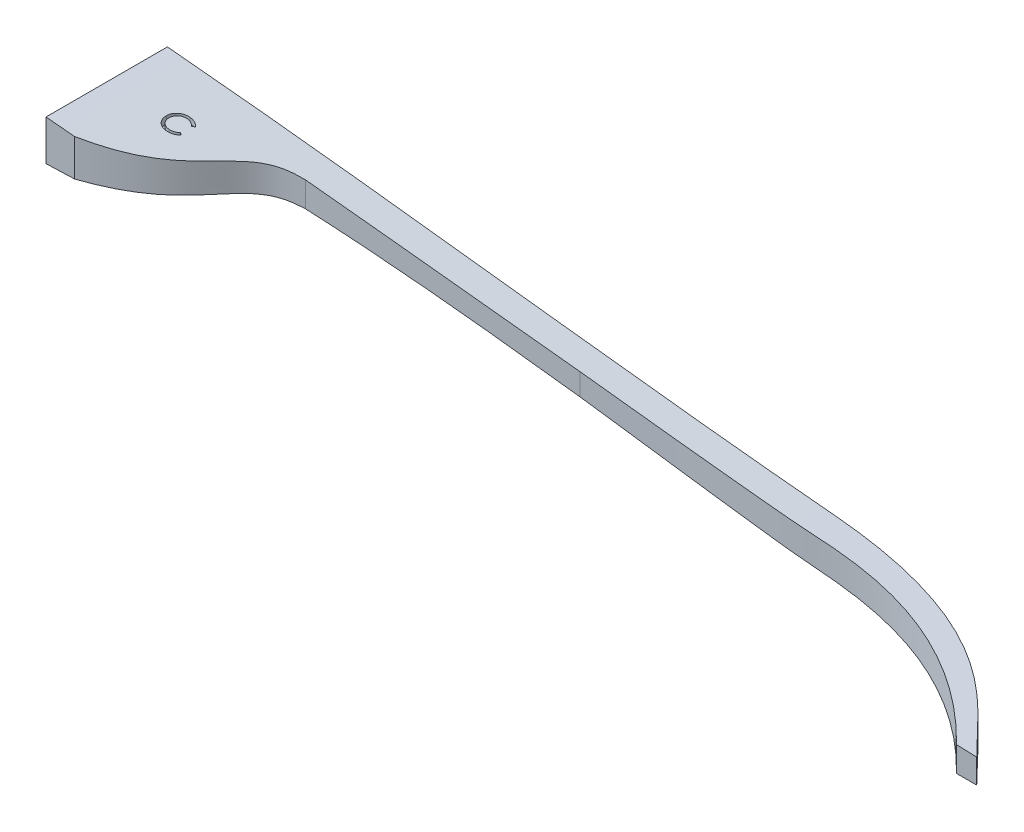
from build123d import *

# Parameters (mm, degrees)
SKETCH1_W           = 146.05
SKETCH1_H           = 19.05
BOSS_EXTRUDE1_DEPTH = 17.78
CUT_EXTRUDE7_DEPTH  = 1.905
CUT_EXTRUDE2_DEPTH  = 19.05
CUT_EXTRUDE3_DEPTH  = 149.356440496
SKETCH5_W           = 6.985
SKETCH5_H           = 3.81
CUT_EXTRUDE4_DEPTH  = 6.35


with BuildPart() as part:
    # Sketch1 → Boss-Extrude1 (new body)
    with BuildSketch(Plane(origin=(0, 0, 0), x_dir=(1, 0, 0), z_dir=(0, 1, 0))):
        with Locations((73.025, 9.525)):
            Rectangle(SKETCH1_W, SKETCH1_H)
    extrude(amount=BOSS_EXTRUDE1_DEPTH)

    # Sketch8 → Cut-Extrude7 (cut)
    with BuildSketch(Plane(origin=(0, 17.78, 0), x_dir=(1, 0, 0), z_dir=(0, 1, 0))):
        with BuildLine():
            Line((11.932128465, 11.486459651), (11.57455635, 11.239664779))
            add(Edge.make_bspline(
                [(11.57455635, 11.239664779), (11.53172956, 11.286575166), (11.447891005, 11.378407848), (11.309829616, 11.498702995), (11.165342586, 11.599950223), (11.014226465, 11.681812452), (10.856321257, 11.745897608), (10.690796367, 11.790426079), (10.517478862, 11.81786797), (10.399345319, 11.821266988), (10.339179747, 11.822998113)],
                knots=[0, 0, 0, 0, 1.078723025, 2.111729107, 3.104379151, 4.071093171, 5.02612831, 5.993405043, 6.978038489, 8, 8, 8, 8], degree=3))
            add(Edge.make_bspline(
                [(10.339179747, 11.822998113), (10.307836215, 11.822546335), (10.245481403, 11.821647569), (10.153078916, 11.811766265), (10.062089791, 11.798241519), (9.972599637, 11.777692061), (9.884767432, 11.750827483), (9.797994731, 11.719672741), (9.713595602, 11.681084488), (9.630751308, 11.638193888), (9.550704857, 11.589951467), (9.475308209, 11.536369665), (9.403189626, 11.479842707), (9.336388016, 11.417697997), (9.274293762, 11.351026195), (9.215546672, 11.280666308), (9.161631577, 11.205703155), (9.112755709, 11.126361469), (9.068173442, 11.043823418), (9.030759351, 10.957484072), (8.998276838, 10.86880811), (8.971320731, 10.777333782), (8.95138381, 10.682784014), (8.936600862, 10.585416173), (8.92712747, 10.485445925), (8.92619062, 10.417737437), (8.925718209, 10.383595068)],
                knots=[0, 0, 0, 0, 1.002068956, 1.993515617, 2.969284448, 3.943018425, 4.926742606, 5.905741285, 6.889351865, 7.892340394, 8.888397413, 9.875523532, 10.849114049, 11.817064186, 12.790109362, 13.76151668, 14.746886598, 15.740472426, 16.740336546, 17.744438579, 18.747064952, 19.759451636, 20.791569268, 21.834966327, 22.908270136, 24, 24, 24, 24], degree=3))
            add(Edge.make_bspline(
                [(8.925718209, 10.383595068), (8.926799751, 10.332343515), (8.928916902, 10.232017043), (8.949380339, 10.085113849), (8.981310526, 9.945120222), (9.026194736, 9.812047218), (9.084190454, 9.686046008), (9.155143307, 9.567323598), (9.239461581, 9.455590508), (9.335747465, 9.352290971), (9.440708175, 9.257488649), (9.55446663, 9.176376835), (9.673127361, 9.105941915), (9.799035599, 9.05001724), (9.93041216, 9.005539524), (10.068273824, 8.974033221), (10.212192349, 8.954701996), (10.310372778, 8.952381317), (10.360213401, 8.951203241)],
                knots=[0, 0, 0, 0, 1.083728652, 2.12143175, 3.131304262, 4.117911469, 5.086904967, 6.060353746, 7.03835, 8.042493243, 9.043967071, 10.025107856, 10.993520914, 11.958418665, 12.934074928, 13.923564625, 14.94591178, 16, 16, 16, 16], degree=3))
            add(Edge.make_bspline(
                [(10.360213401, 8.951203241), (10.418050068, 8.952903366), (10.532281202, 8.956261223), (10.70024387, 8.984544599), (10.862080114, 9.030227247), (11.01796467, 9.094625533), (11.168024773, 9.17710669), (11.311555466, 9.278304909), (11.449356682, 9.397305108), (11.533116726, 9.488097684), (11.575958593, 9.534536574)],
                knots=[0, 0, 0, 0, 0.996377973, 1.967910503, 2.926842387, 3.889624876, 4.868586907, 5.872161968, 6.91164629, 8, 8, 8, 8], degree=3))
            Line((11.575958593, 9.534536574), (11.932128465, 9.289143946))
            add(Edge.make_bspline(
                [(11.932128465, 9.289143946), (11.909071554, 9.259903879), (11.86326047, 9.201807669), (11.789278996, 9.119632833), (11.711570735, 9.042347725), (11.629370462, 8.97066921), (11.54276612, 8.904667008), (11.452163491, 8.843576883), (11.357649639, 8.787496), (11.259276198, 8.737024464), (11.157603595, 8.69185179), (11.052424246, 8.653811108), (10.944746189, 8.620252994), (10.833619979, 8.593980706), (10.719479426, 8.572687756), (10.602147752, 8.558395807), (10.482137997, 8.548722452), (10.401131723, 8.547815308), (10.360213401, 8.547357087)],
                knots=[0, 0, 0, 0, 0.990136069, 1.967271632, 2.938597646, 3.903378639, 4.8655934, 5.832714132, 6.808088679, 7.786607084, 8.77175572, 9.76479442, 10.759640537, 11.769709565, 12.799869661, 13.846050076, 14.911985293, 16, 16, 16, 16], degree=3))
            add(Edge.make_bspline(
                [(10.360213401, 8.547357087), (10.322569331, 8.547612202), (10.248366042, 8.54811508), (10.13870474, 8.556564359), (10.031949405, 8.567989743), (9.928387794, 8.585130595), (9.827531235, 8.605657011), (9.730202952, 8.632872594), (9.635082474, 8.663231125), (9.543553811, 8.699945526), (9.45492684, 8.740773743), (9.368889784, 8.785520758), (9.286289074, 8.836009308), (9.207055953, 8.891749018), (9.130257789, 8.951336683), (9.056671308, 9.016099043), (8.985530866, 9.085211402), (8.941530607, 9.13506972), (8.919408112, 9.160137536)],
                knots=[0, 0, 0, 0, 1.116169561, 2.200172621, 3.260333751, 4.299600589, 5.312386579, 6.311224183, 7.295427787, 8.272379731, 9.233840239, 10.188782295, 11.146938977, 12.102635432, 13.060741968, 14.028403985, 15.00871894, 16, 16, 16, 16], degree=3))
            add(Edge.make_bspline(
                [(8.919408112, 9.160137536), (8.883944931, 9.20366169), (8.813651007, 9.289933806), (8.72406028, 9.430164565), (8.646785982, 9.576115754), (8.585388491, 9.72986681), (8.536858675, 9.88960447), (8.501487184, 10.055816154), (8.4811066, 10.229070415), (8.478384332, 10.346849916), (8.47700026, 10.406732087)],
                knots=[0, 0, 0, 0, 0.995996121, 1.974230005, 2.94855815, 3.923972302, 4.908363682, 5.909282248, 6.937024559, 8, 8, 8, 8], degree=3))
            add(Edge.make_bspline(
                [(8.47700026, 10.406732087), (8.478562815, 10.469684645), (8.481637044, 10.593539872), (8.507527772, 10.775355155), (8.54971352, 10.949279125), (8.607696721, 11.116062302), (8.684530402, 11.274340153), (8.776158839, 11.426157948), (8.886969267, 11.568686935), (9.01150876, 11.703161365), (9.148528276, 11.826229507), (9.296499011, 11.932949489), (9.452261077, 12.024147053), (9.616388101, 12.098854544), (9.789324806, 12.156728981), (9.970785294, 12.19676679), (10.160380489, 12.222118894), (10.289552125, 12.225250272), (10.355305548, 12.226844266)],
                knots=[0, 0, 0, 0, 1.034323922, 2.034967744, 3.011348252, 3.972313581, 4.931003742, 5.898099022, 6.881526582, 7.89265862, 8.907395938, 9.903191422, 10.886146247, 11.869423756, 12.861842533, 13.877618994, 14.91962492, 16, 16, 16, 16], degree=3))
            add(Edge.make_bspline(
                [(10.355305548, 12.226844266), (10.3966885, 12.226365092), (10.478622879, 12.225416372), (10.600099981, 12.216042575), (10.718494345, 12.200656357), (10.833829616, 12.179462578), (10.946447166, 12.153273403), (11.055750971, 12.119124943), (11.162360384, 12.080114688), (11.265557787, 12.035075365), (11.365089947, 11.984971266), (11.459828451, 11.928447423), (11.550427922, 11.86767324), (11.636166203, 11.801381986), (11.717614752, 11.730666673), (11.794375792, 11.654713368), (11.866049385, 11.573214036), (11.910028356, 11.515474603), (11.932128465, 11.486459651)],
                knots=[0, 0, 0, 0, 1.097463626, 2.172875475, 3.229307817, 4.262776093, 5.282168658, 6.293918414, 7.298043722, 8.291879901, 9.278790577, 10.251524626, 11.216027204, 12.170719329, 13.124142787, 14.075306658, 15.032812027, 16, 16, 16, 16], degree=3))
        make_face()
    extrude(amount=-CUT_EXTRUDE7_DEPTH, mode=Mode.SUBTRACT)

    # Sketch4 → Cut-Extrude2 (cut)
    with BuildSketch(Plane(origin=(0, 17.78, 0), x_dir=(1, 0, 0), z_dir=(0, 1, 0))):
        with BuildLine():
            add(Edge.make_bspline(
                [(4.476723392, 0), (17.725756487, 4.043101895), (17.090749047, 12.999753789), (25.262791442, 14.373397692), (26.219517358, 14.465775476)],
                knots=[0, 0, 0, 0, 0.256127126, 0.284585695, 0.284585695, 0.284585695, 0.284585695], degree=3))
            Line((4.476723392, 0), (142.875, 0))
            add(Edge.make_bspline(
                [(68.923918907, 14.861089556), (81.075041449, 14.855684794), (98.246564786, 14.797098309), (108.068516517, 14.713978549), (127.226778846, 16.049688466), (142.875, 0)],
                knots=[0.488488537, 0.488488537, 0.488488537, 0.488488537, 0.629203286, 0.700744717, 1, 1, 1, 1], degree=3))
            Line((68.923918907, 14.861089556), (26.219517358, 14.465775476))
        make_face()
        with BuildLine():
            add(Edge.make_bspline(
                [(105.157866441, 19.05), (131.491281961, 18.918345897), (139.296835945, 6.588803862), (146.05, 0)],
                knots=[0.010622627, 0.010622627, 0.010622627, 0.010622627, 1, 1, 1, 1], degree=3))
            Line((146.05, 0), (146.05, 19.05))
            Line((146.05, 19.05), (105.157866441, 19.05))
        make_face()
    extrude(amount=-CUT_EXTRUDE2_DEPTH, mode=Mode.SUBTRACT)

    # Sketch3 → Cut-Extrude3 (cut, through all)
    with BuildSketch(Plane(origin=(0, 0, -19.05), x_dir=(-1, 0, 0), z_dir=(0, 0, -1))):
        with BuildLine():
            Line((0, 0), (0, 11.43))
            add(Edge.make_bspline(
                [(0, 11.43), (-26.792555724, 12.634357911), (-72.280792131, 6.201792572), (-116.932982784, 0.404820603), (-135.233810626, 0)],
                knots=[0, 0, 0, 0, 0.551607579, 0.926374566, 0.926374566, 0.926374566, 0.926374566], degree=3))
            Line((-135.233810626, 0), (0, 0))
        make_face()
        with BuildLine():
            add(Edge.make_bspline(
                [(0, 17.78), (-48.672976034, 13.412806226), (-97.125115455, 5.394093058), (-146.05, 3.81)],
                knots=[0, 0, 0, 0, 1, 1, 1, 1], degree=3))
            Line((0, 17.78), (-146.05, 17.78))
            Line((-146.05, 17.78), (-146.05, 3.81))
        make_face()
    extrude(amount=-CUT_EXTRUDE3_DEPTH, mode=Mode.SUBTRACT)

    # Sketch5 → Cut-Extrude4 (cut)
    with BuildSketch(Plane.ZY):
        with Locations((-9.2075, 13.335)):
            Rectangle(SKETCH5_W, SKETCH5_H)
    extrude(amount=-CUT_EXTRUDE4_DEPTH, mode=Mode.SUBTRACT)


solid = part.part
